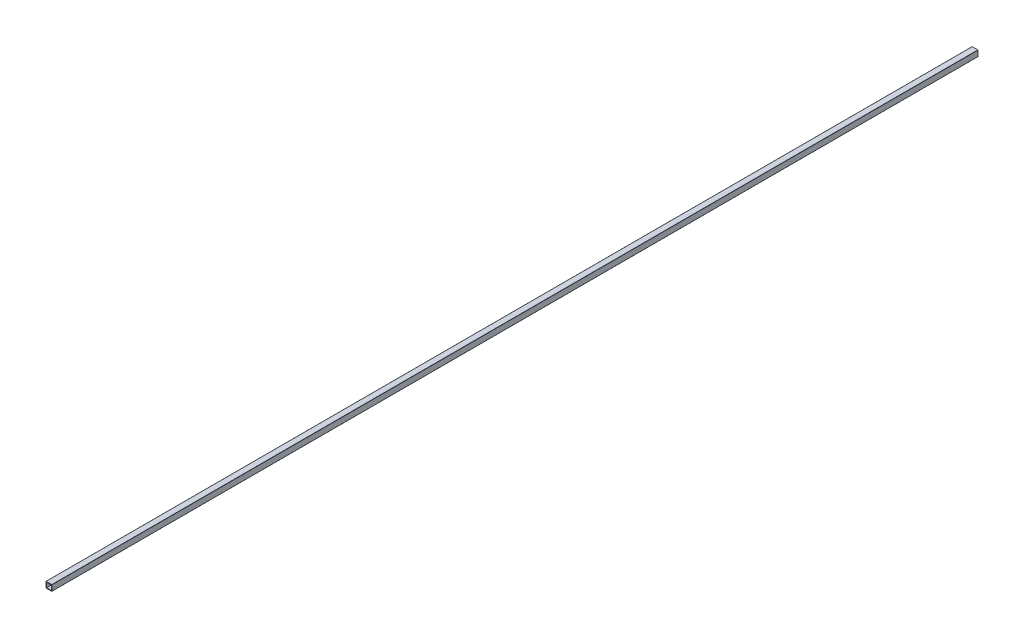
from build123d import *

# Parameters (mm, degrees)
CROQUIS1_W              = 30.5
CROQUIS1_H              = 30.5
SALIENTE_EXTRUIR1_DEPTH = 6000


with BuildPart() as part:
    # Croquis1 → Saliente-Extruir1 (new body)
    with BuildSketch(Plane.XY):
        with BuildLine():
            Line((-18.05, -19.05), (18.05, -19.05))
            ThreePointArc((18.05, -19.05), (18.757106781, -18.757106781), (19.05, -18.05))
            Line((19.05, -18.05), (19.05, 18.05))
            ThreePointArc((19.05, 18.05), (18.757106781, 18.757106781), (18.05, 19.05))
            Line((18.05, 19.05), (-18.05, 19.05))
            ThreePointArc((-18.05, 19.05), (-18.757106781, 18.757106781), (-19.05, 18.05))
            Line((-19.05, 18.05), (-19.05, -18.05))
            ThreePointArc((-19.05, -18.05), (-18.757106781, -18.757106781), (-18.05, -19.05))
        make_face()
        Rectangle(CROQUIS1_W, CROQUIS1_H, mode=Mode.SUBTRACT)
    extrude(amount=SALIENTE_EXTRUIR1_DEPTH)


solid = part.part
